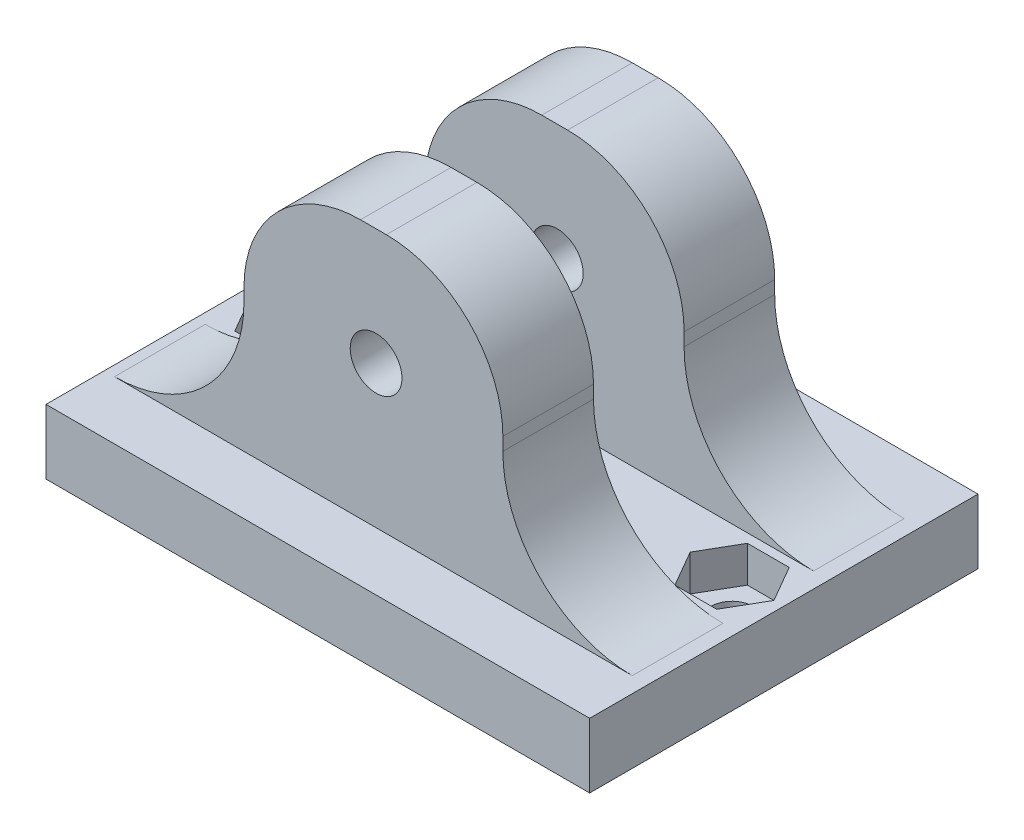
from build123d import *

# Parameters (mm, degrees)
CROQUIS1_W                 = 42
CROQUIS1_H                 = 5
SALIENTE_EXTRUIR1_DEPTH    = 30
CORTAR_EXTRUIR1_DEPTH      = 15
CORTAR_EXTRUIR1_DEPTH_BACK = 21
CROQUIS2_R                 = 1.6
CORTAR_EXTRUIR2_DEPTH      = 2.8
CROQUIS4_W                 = 20
CROQUIS4_H                 = 7
SALIENTE_EXTRUIR2_DEPTH    = 20
FILLET1_R                  = 9
CUT_EXTRUDE1_DEPTH         = 15
CUT_EXTRUDE1_DEPTH_BACK    = 32
SKETCH1_R                  = 2
FILLET2_R                  = 10


with BuildPart() as part:
    # Croquis1 → Saliente-Extruir1 (new body)
    with BuildSketch(Plane.XY):
        with Locations((0, 2.5)):
            Rectangle(CROQUIS1_W, CROQUIS1_H)
    extrude(amount=SALIENTE_EXTRUIR1_DEPTH)

    # Croquis2 → Cortar-Extruir1 (cut, two sides: drawn at the far end of the back side and taken through both)
    with BuildSketch(Plane(origin=(0, 5, 0), x_dir=(1, 0, 0), z_dir=(0, 1, 0)).offset(-CORTAR_EXTRUIR1_DEPTH_BACK)):
        with Locations((-17, -15)):
            Circle(CROQUIS2_R)
        with Locations((17, -15)):
            Circle(CROQUIS2_R)
    extrude(amount=CORTAR_EXTRUIR1_DEPTH + CORTAR_EXTRUIR1_DEPTH_BACK, mode=Mode.SUBTRACT)

    # Croquis3 → Cortar-Extruir2 (cut)
    with BuildSketch(Plane(origin=(0, 5, 0), x_dir=(1, 0, 0), z_dir=(0, 1, 0))):
        Polygon((15.383419246, -17.8), (13.766838493, -15), (15.383419246, -12.2), (18.616580754, -12.2), (20.233161507, -15), (18.616580754, -17.8), align=None)
        Polygon((-13.766838493, -15), (-15.383419246, -12.2), (-18.616580754, -12.2), (-20.233161507, -15), (-18.616580754, -17.8), (-15.383419246, -17.8), align=None)
    extrude(amount=-CORTAR_EXTRUIR2_DEPTH, mode=Mode.SUBTRACT)

    # Croquis4 → Saliente-Extruir2 (add)
    with BuildSketch(Plane(origin=(0, 5, 0), x_dir=(1, 0, 0), z_dir=(0, 1, 0))):
        with Locations((-0.205428596, -22)):
            Rectangle(CROQUIS4_W, CROQUIS4_H)
        with Locations((-0.205428596, -8)):
            Rectangle(CROQUIS4_W, CROQUIS4_H)
    extrude(amount=SALIENTE_EXTRUIR2_DEPTH)

    # Fillet1
    fillet1_edges = [part.edges().sort_by_distance(p)[0] for p in [
        (-10.205428596, 25, 22),
        (9.794571404, 25, 22),
        (-10.205428596, 25, 8),
        (9.794571404, 25, 8),
    ]]
    fillet(fillet1_edges, radius=FILLET1_R)

    # Sketch1 → Cut-Extrude1 (cut, two sides: drawn at the far end of the back side and taken through both)
    with BuildSketch(Plane.XY.offset(25.5).offset(-CUT_EXTRUDE1_DEPTH_BACK)):
        with Locations(Location((0, 16, 0), (0, 0, 180))):
            Circle(SKETCH1_R)
    extrude(amount=CUT_EXTRUDE1_DEPTH + CUT_EXTRUDE1_DEPTH_BACK, mode=Mode.SUBTRACT)

    # Fillet2
    fillet2_edges = [part.edges().sort_by_distance(p)[0] for p in [
        (-10.205428596, 5, 22),
        (9.794571404, 5, 22),
        (-10.205428596, 5, 8),
        (9.794571404, 5, 8),
    ]]
    fillet(fillet2_edges, radius=FILLET2_R)


solid = part.part
